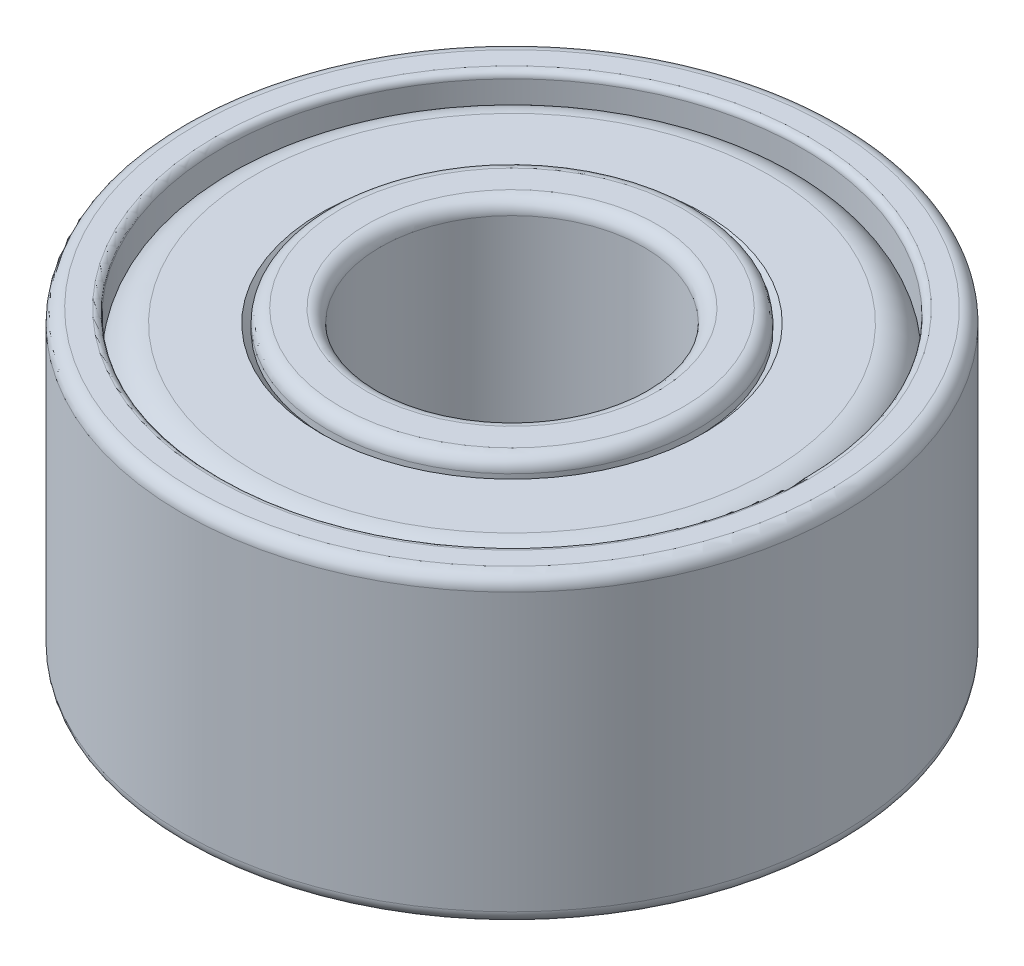
from build123d import *

# Parameters (mm, degrees)
SKETCH2_R           = 1.4
SKETCH2_R_2         = 1
BOSS_EXTRUDE1_DEPTH = 1.15
SKETCH4_R           = 2.5
SKETCH4_R_2         = 2.2
BOSS_EXTRUDE2_DEPTH = 1.15
FILLET1_R           = 0.1
FILLET2_R           = 0.1
FILLET3_R           = 0.05
SKETCH5_R           = 2.2
SKETCH5_R_2         = 1.4
BOSS_EXTRUDE3_DEPTH = 1.05
FILLET4_R           = 0.25
CHAMFER1_SIZE       = 0.05


with BuildPart() as part:
    # Sketch2 → Boss-Extrude1 (new, symmetric)
    with BuildSketch(Plane(origin=(0, 0, 0), x_dir=(1, 0, 0), z_dir=(0, 1, 0))):
        with Locations(Location((0, 0, 0), (0, 0, 270))):
            Circle(SKETCH2_R)
        with Locations(Location((0, 0, 0), (0, 0, 270))):
            Circle(SKETCH2_R_2, mode=Mode.SUBTRACT)
    extrude(amount=BOSS_EXTRUDE1_DEPTH, both=True)

    # Fillet1
    fillet1_edges = [part.edges().sort_by_distance(p)[0] for p in [
        (0, -1.15, -1.4),
        (0, 1.15, -1.4),
        (0, -1.15, -1),
        (0, 1.15, -1),
    ]]
    fillet(fillet1_edges, radius=FILLET1_R)


with BuildPart() as body_2:
    # Sketch4 → Boss-Extrude2 (new, symmetric)
    with BuildSketch(Plane(origin=(0, 0, 0), x_dir=(1, 0, 0), z_dir=(0, 1, 0))):
        with Locations(Location((0, 0, 0), (0, 0, 270))):
            Circle(SKETCH4_R)
        with Locations(Location((0, 0, 0), (0, 0, 270))):
            Circle(SKETCH4_R_2, mode=Mode.SUBTRACT)
    extrude(amount=BOSS_EXTRUDE2_DEPTH, both=True)

    # Fillet2
    fillet2_edges = [body_2.edges().sort_by_distance(p)[0] for p in [
        (0, -1.15, -2.5),
        (0, 1.15, -2.5),
    ]]
    fillet(fillet2_edges, radius=FILLET2_R)

    # Fillet3
    fillet3_edges = [body_2.edges().sort_by_distance(p)[0] for p in [
        (0, -1.15, -2.2),
        (0, 1.15, -2.2),
    ]]
    fillet(fillet3_edges, radius=FILLET3_R)


with BuildPart() as body_3:
    # Sketch5 → Boss-Extrude3 (new, symmetric)
    with BuildSketch(Plane(origin=(0, 0, 0), x_dir=(1, 0, 0), z_dir=(0, 1, 0))):
        with Locations(Location((0, 0, 0), (0, 0, 270))):
            Circle(SKETCH5_R)
        with Locations(Location((0, 0, 0), (0, 0, 270))):
            Circle(SKETCH5_R_2, mode=Mode.SUBTRACT)
    extrude(amount=BOSS_EXTRUDE3_DEPTH, both=True)

    # Fillet4
    fillet4_edges = [body_3.edges().sort_by_distance(p)[0] for p in [
        (0, -1.05, -2.2),
        (0, 1.05, -2.2),
    ]]
    fillet(fillet4_edges, radius=FILLET4_R)

    # Chamfer1
    chamfer1_edges = [body_3.edges().sort_by_distance(p)[0] for p in [
        (0, -1.05, -1.4),
        (0, 1.05, -1.4),
    ]]
    chamfer(chamfer1_edges, length=CHAMFER1_SIZE)


solid = Compound([part.part, body_2.part, body_3.part])
